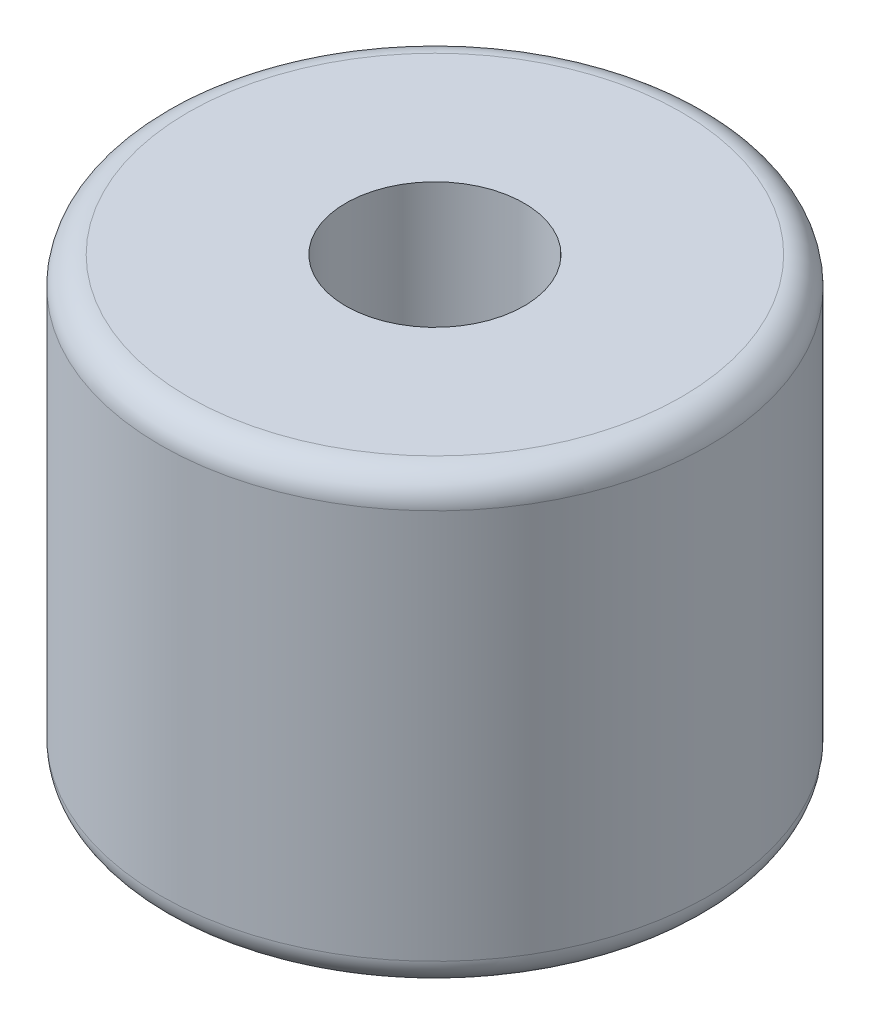
from build123d import *

# Parameters (mm, degrees)
SKETCH_1_R      = 4.925
SKETCH_1_R_2    = 1.6
EXTRUDE_1_DEPTH = 8
FILLET_1_R      = 0.5


with BuildPart() as part:
    # 草图1 → 凸台-拉伸1 (new body)
    with BuildSketch(Plane(origin=(0, 0, 0), x_dir=(1, 0, 0), z_dir=(0, 1, 0))):
        with Locations(Location((0, 0, 0), (0, 0, 270))):
            Circle(SKETCH_1_R)
        with Locations(Location((0, 0, 0), (0, 0, 270))):
            Circle(SKETCH_1_R_2, mode=Mode.SUBTRACT)
    extrude(amount=EXTRUDE_1_DEPTH)

    # 圆角1
    fillet_1_edges = [part.edges().sort_by_distance(p)[0] for p in [
        (0, 0, -4.925),
        (0, 8, -4.925),
        (0, 0, -1.6),
    ]]
    fillet(fillet_1_edges, radius=FILLET_1_R)


solid = part.part
